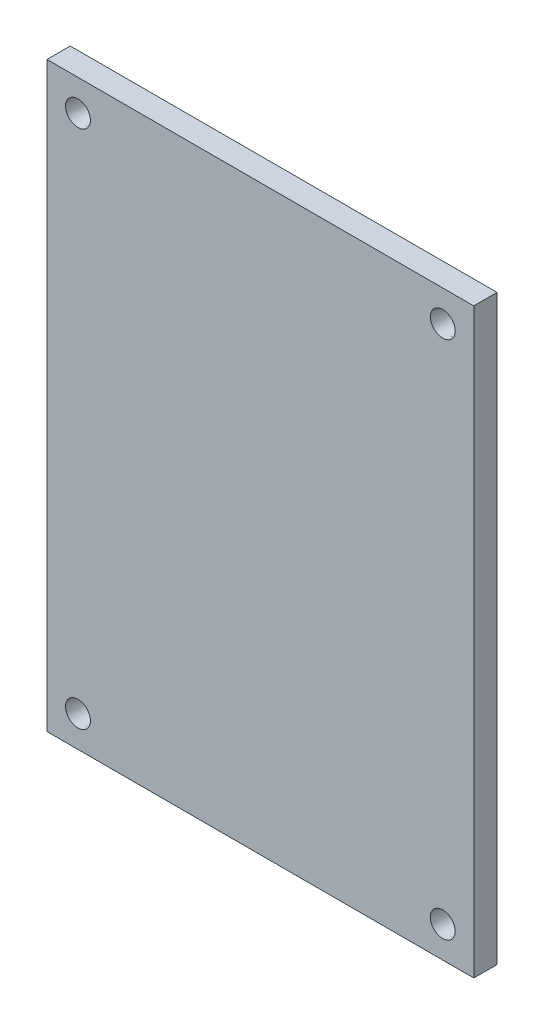
from build123d import *

# Parameters (mm, degrees)
SKETCH1_W           = 75
SKETCH1_H           = 55
BOSS_EXTRUDE1_DEPTH = 3


with BuildPart() as part:
    # Sketch1 → Boss-Extrude1 (new body)
    with BuildSketch(Plane(origin=(0, 0, 0), x_dir=(0, 1, 0), z_dir=(0, 0, 1))):
        Rectangle(SKETCH1_W, SKETCH1_H)
    extrude(amount=BOSS_EXTRUDE1_DEPTH)

    # Cut-Extrude1 cone 1 section (through the dimple's axis) → Cut-Extrude1 (revolve, cut)
    with BuildSketch(Plane(origin=(-23.5, 33.5, 3), x_dir=(0, -1, 0), z_dir=(1, 0, 0))):
        Polygon((0, 0), (1.6, 0), (0, 18.288083684), align=None)
    revolve(axis=Axis((-23.5, 33.5, 3), (0, 0, -1)), mode=Mode.SUBTRACT)

    # Cut-Extrude1 cone 2 section (through the dimple's axis) → Cut-Extrude1 cone 2 (revolve, cut)
    with BuildSketch(Plane(origin=(23.5, 33.5, 3), x_dir=(0, -1, 0), z_dir=(1, 0, 0))):
        Polygon((0, 0), (1.6, 0), (0, 18.288083684), align=None)
    revolve(axis=Axis((23.5, 33.5, 3), (0, 0, -1)), mode=Mode.SUBTRACT)

    # Cut-Extrude1 cone 3 section (through the dimple's axis) → Cut-Extrude1 cone 3 (revolve, cut)
    with BuildSketch(Plane(origin=(-23.5, -33.5, 3), x_dir=(0, -1, 0), z_dir=(1, 0, 0))):
        Polygon((0, 0), (1.6, 0), (0, 18.288083684), align=None)
    revolve(axis=Axis((-23.5, -33.5, 3), (0, 0, -1)), mode=Mode.SUBTRACT)

    # Cut-Extrude1 cone 4 section (through the dimple's axis) → Cut-Extrude1 cone 4 (revolve, cut)
    with BuildSketch(Plane(origin=(23.5, -33.5, 3), x_dir=(0, -1, 0), z_dir=(1, 0, 0))):
        Polygon((0, 0), (1.6, 0), (0, 18.288083684), align=None)
    revolve(axis=Axis((23.5, -33.5, 3), (0, 0, -1)), mode=Mode.SUBTRACT)


solid = part.part
